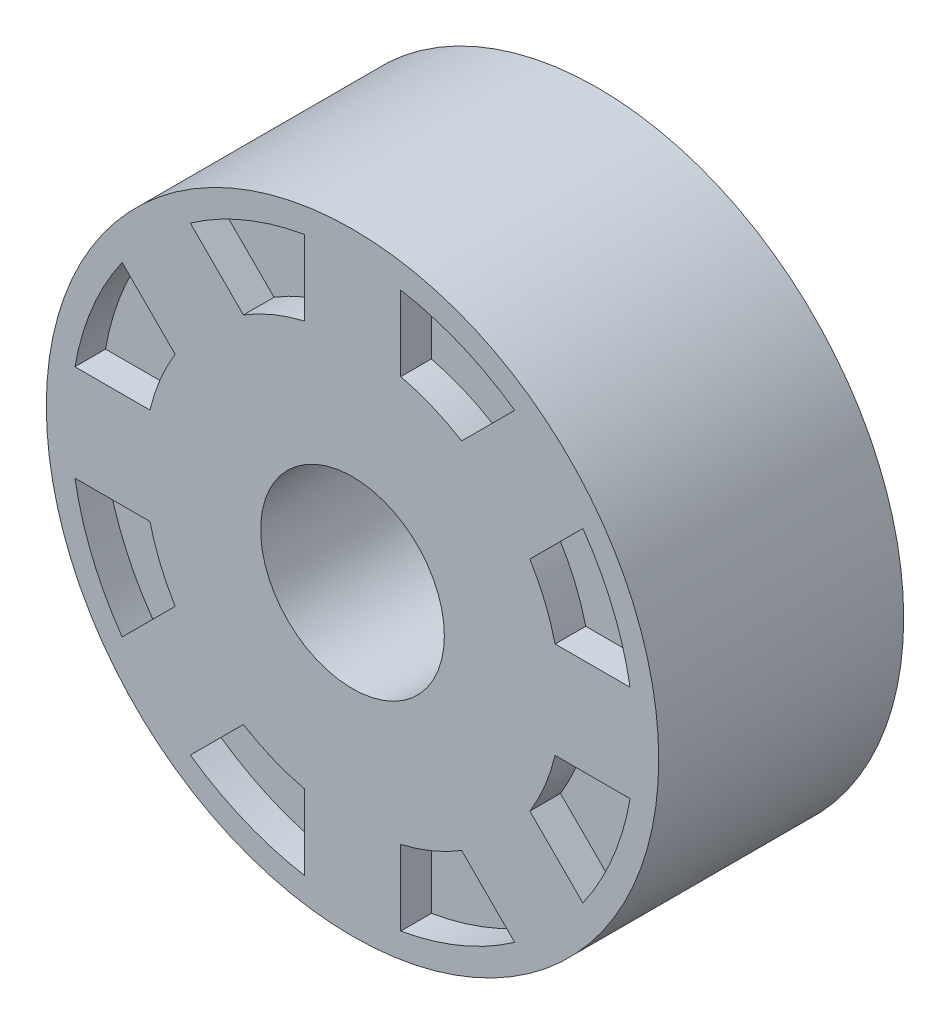
from build123d import *

# Parameters (mm, degrees)
SKETCH1_R           = 63.5
SKETCH1_R_2         = 19.05
BOSS_EXTRUDE1_DEPTH = 25.4
CUT_EXTRUDE1_DEPTH  = 6.35
CUT_EXTRUDE2_START  = -6.35
CUT_EXTRUDE2_DEPTH  = 6.35


with BuildPart() as part:
    # Sketch1 → Boss-Extrude1 (new, symmetric)
    with BuildSketch(Plane.XY):
        Circle(SKETCH1_R)
        Circle(SKETCH1_R_2, mode=Mode.SUBTRACT)
    extrude(amount=BOSS_EXTRUDE1_DEPTH, both=True)

    # Sketch3 → Cut-Extrude1 (cut)
    with BuildSketch(Plane.XY.offset(25.4)):
        with BuildLine():
            Line((36.77386566, 22.631730036), (47.770554295, 33.628418671))
            ThreePointArc((47.770554295, 33.628418671), (53.973042289, 22.356366119), (57.557765766, 10))
            Line((57.557765766, 10), (42.006099557, 10))
            ThreePointArc((42.006099557, 10), (39.893118214, 16.52427061), (36.77386566, 22.631730036))
        make_face()
        with BuildLine():
            Line((47.770554295, -33.628418671), (36.77386566, -22.631730036))
            ThreePointArc((36.77386566, -22.631730036), (39.893118214, -16.52427061), (42.006099557, -10))
            Line((42.006099557, -10), (57.557765766, -10))
            ThreePointArc((57.557765766, -10), (53.973042289, -22.356366119), (47.770554295, -33.628418671))
        make_face()
        with BuildLine():
            Line((10, -57.557765766), (10, -42.006099557))
            ThreePointArc((10, -42.006099557), (16.52427061, -39.893118214), (22.631730036, -36.77386566))
            Line((22.631730036, -36.77386566), (33.628418671, -47.770554295))
            ThreePointArc((33.628418671, -47.770554295), (22.356366119, -53.973042289), (10, -57.557765766))
        make_face()
        with BuildLine():
            Line((-33.628418671, -47.770554295), (-22.631730036, -36.77386566))
            ThreePointArc((-22.631730036, -36.77386566), (-16.52427061, -39.893118214), (-10, -42.006099557))
            Line((-10, -42.006099557), (-10, -57.557765766))
            ThreePointArc((-10, -57.557765766), (-22.356366119, -53.973042289), (-33.628418671, -47.770554295))
        make_face()
        with BuildLine():
            Line((-42.006099557, 10), (-57.557765766, 10))
            ThreePointArc((-57.557765766, 10), (-53.973042289, 22.356366119), (-47.770554295, 33.628418671))
            Line((-47.770554295, 33.628418671), (-36.77386566, 22.631730036))
            ThreePointArc((-36.77386566, 22.631730036), (-39.893118214, 16.52427061), (-42.006099557, 10))
        make_face()
        with BuildLine():
            Line((22.631730036, 36.77386566), (33.628418671, 47.770554295))
            ThreePointArc((33.628418671, 47.770554295), (22.356366119, 53.973042289), (10, 57.557765766))
            Line((10, 57.557765766), (10, 42.006099557))
            ThreePointArc((10, 42.006099557), (16.52427061, 39.893118214), (22.631730036, 36.77386566))
        make_face()
        with BuildLine():
            Line((-47.770554295, -33.628418671), (-36.77386566, -22.631730036))
            ThreePointArc((-36.77386566, -22.631730036), (-39.893118214, -16.52427061), (-42.006099557, -10))
            Line((-42.006099557, -10), (-57.557765766, -10))
            ThreePointArc((-57.557765766, -10), (-53.973042289, -22.356366119), (-47.770554295, -33.628418671))
        make_face()
        with BuildLine():
            Line((-22.631730036, 36.77386566), (-33.628418671, 47.770554295))
            ThreePointArc((-33.628418671, 47.770554295), (-22.356366119, 53.973042289), (-10, 57.557765766))
            Line((-10, 57.557765766), (-10, 42.006099557))
            ThreePointArc((-10, 42.006099557), (-16.52427061, 39.893118214), (-22.631730036, 36.77386566))
        make_face()
    extrude(amount=-CUT_EXTRUDE1_DEPTH, mode=Mode.SUBTRACT)

    # Sketch4 → Cut-Extrude2 (cut)
    with BuildSketch(Plane(origin=(0, 0, -25.4), x_dir=(-1, 0, 0), z_dir=(0, 0, -1)).offset(CUT_EXTRUDE2_START)):
        with BuildLine():
            Line((-36.77386566, -22.631730036), (-47.770554295, -33.628418671))
            ThreePointArc((-47.770554295, -33.628418671), (-53.973042289, -22.356366119), (-57.557765766, -10))
            Line((-57.557765766, -10), (-42.006099557, -10))
            ThreePointArc((-42.006099557, -10), (-39.893118214, -16.52427061), (-36.77386566, -22.631730036))
        make_face()
        with BuildLine():
            Line((-10, -42.006099557), (-10, -57.557765766))
            ThreePointArc((-10, -57.557765766), (-22.356366119, -53.973042289), (-33.628418671, -47.770554295))
            Line((-33.628418671, -47.770554295), (-22.631730036, -36.77386566))
            ThreePointArc((-22.631730036, -36.77386566), (-16.52427061, -39.893118214), (-10, -42.006099557))
        make_face()
        with BuildLine():
            Line((22.631730036, -36.77386566), (33.628418671, -47.770554295))
            ThreePointArc((33.628418671, -47.770554295), (22.356366119, -53.973042289), (10, -57.557765766))
            Line((10, -57.557765766), (10, -42.006099557))
            ThreePointArc((10, -42.006099557), (16.52427061, -39.893118214), (22.631730036, -36.77386566))
        make_face()
        with BuildLine():
            Line((42.006099557, -10), (57.557765766, -10))
            ThreePointArc((57.557765766, -10), (53.973042289, -22.356366119), (47.770554295, -33.628418671))
            Line((47.770554295, -33.628418671), (36.77386566, -22.631730036))
            ThreePointArc((36.77386566, -22.631730036), (39.893118214, -16.52427061), (42.006099557, -10))
        make_face()
        with BuildLine():
            Line((36.77386566, 22.631730036), (47.770554295, 33.628418671))
            ThreePointArc((47.770554295, 33.628418671), (53.973042289, 22.356366119), (57.557765766, 10))
            Line((57.557765766, 10), (42.006099557, 10))
            ThreePointArc((42.006099557, 10), (39.893118214, 16.52427061), (36.77386566, 22.631730036))
        make_face()
        with BuildLine():
            Line((10, 42.006099557), (10, 57.557765766))
            ThreePointArc((10, 57.557765766), (22.356366119, 53.973042289), (33.628418671, 47.770554295))
            Line((33.628418671, 47.770554295), (22.631730036, 36.77386566))
            ThreePointArc((22.631730036, 36.77386566), (16.52427061, 39.893118214), (10, 42.006099557))
        make_face()
        with BuildLine():
            Line((-22.631730036, 36.77386566), (-33.628418671, 47.770554295))
            ThreePointArc((-33.628418671, 47.770554295), (-22.356366119, 53.973042289), (-10, 57.557765766))
            Line((-10, 57.557765766), (-10, 42.006099557))
            ThreePointArc((-10, 42.006099557), (-16.52427061, 39.893118214), (-22.631730036, 36.77386566))
        make_face()
        with BuildLine():
            Line((-42.006099557, 10), (-57.557765766, 10))
            ThreePointArc((-57.557765766, 10), (-53.973042289, 22.356366119), (-47.770554295, 33.628418671))
            Line((-47.770554295, 33.628418671), (-36.77386566, 22.631730036))
            ThreePointArc((-36.77386566, 22.631730036), (-39.893118214, 16.52427061), (-42.006099557, 10))
        make_face()
    extrude(amount=CUT_EXTRUDE2_DEPTH, mode=Mode.SUBTRACT)


solid = part.part
